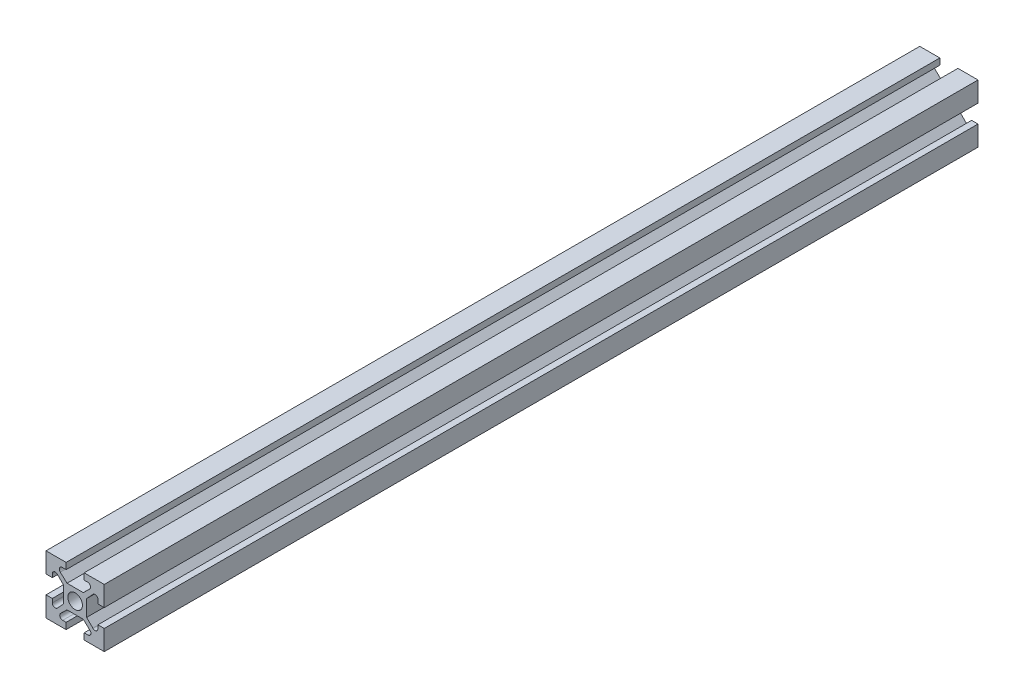
from build123d import *

# Parameters (mm, degrees)
SKETCH2_R           = 2.5
BOSS_EXTRUDE1_DEPTH = 300


with BuildPart() as part:
    # Sketch2 → Boss-Extrude1 (new body)
    with BuildSketch(Plane.XY):
        with BuildLine():
            Line((-10, -10), (-3.1, -10))
            Line((-3.1, -10), (-3.1, -7.81857447))
            Line((-3.1, -7.81857447), (-4.285374034, -7.81857447))
            ThreePointArc((-4.285374034, -7.81857447), (-5.210402021, -7.198473435), (-4.988208383, -6.107220917))
            Line((-4.988208383, -6.107220917), (-2.819718275, -3.96470075))
            Line((-2.819718275, -3.96470075), (0, -3.96470075))
            Line((0, -3.96470075), (2.782738033, -3.96470075))
            Line((2.782738033, -3.96470075), (5.105242131, -6.103332486))
            ThreePointArc((5.105242131, -6.103332486), (5.359419929, -7.202533996), (4.427854938, -7.838959152))
            Line((4.427854938, -7.838959152), (3.1, -7.838959152))
            Line((3.1, -7.838959152), (3.1, -10))
            Line((3.1, -10), (10, -10))
            Line((10, -10), (10, -3.1))
            Line((10, -3.1), (7.81857447, -3.1))
            Line((7.81857447, -3.1), (7.81857447, -4.285374034))
            ThreePointArc((7.81857447, -4.285374034), (7.198473435, -5.210402021), (6.107220917, -4.988208383))
            Line((6.107220917, -4.988208383), (3.96470075, -2.819718275))
            Line((3.96470075, -2.819718275), (3.96470075, 0))
            Line((3.96470075, 0), (3.96470075, 2.782738033))
            Line((3.96470075, 2.782738033), (6.103332486, 5.105242131))
            ThreePointArc((6.103332486, 5.105242131), (7.202533996, 5.359419929), (7.838959152, 4.427854938))
            Line((7.838959152, 4.427854938), (7.838959152, 3.1))
            Line((7.838959152, 3.1), (10, 3.1))
            Line((10, 3.1), (10, 10))
            Line((10, 10), (3.1, 10))
            Line((3.1, 10), (3.1, 7.81857447))
            Line((3.1, 7.81857447), (4.285374034, 7.81857447))
            ThreePointArc((4.285374034, 7.81857447), (5.210402021, 7.198473435), (4.988208383, 6.107220917))
            Line((4.988208383, 6.107220917), (2.819718275, 3.96470075))
            Line((2.819718275, 3.96470075), (0, 3.96470075))
            Line((0, 3.96470075), (-2.782738033, 3.96470075))
            Line((-2.782738033, 3.96470075), (-5.105242131, 6.103332486))
            ThreePointArc((-5.105242131, 6.103332486), (-5.359419929, 7.202533996), (-4.427854938, 7.838959152))
            Line((-4.427854938, 7.838959152), (-3.1, 7.838959152))
            Line((-3.1, 7.838959152), (-3.1, 10))
            Line((-3.1, 10), (-10, 10))
            Line((-10, 10), (-10, 3.1))
            Line((-10, 3.1), (-7.81857447, 3.1))
            Line((-7.81857447, 3.1), (-7.81857447, 4.285374034))
            ThreePointArc((-7.81857447, 4.285374034), (-7.198473435, 5.210402021), (-6.107220917, 4.988208383))
            Line((-6.107220917, 4.988208383), (-3.96470075, 2.819718275))
            Line((-3.96470075, 2.819718275), (-3.96470075, 0))
            Line((-3.96470075, 0), (-3.96470075, -2.782738033))
            Line((-3.96470075, -2.782738033), (-6.103332486, -5.105242131))
            ThreePointArc((-6.103332486, -5.105242131), (-7.202533996, -5.359419929), (-7.838959152, -4.427854938))
            Line((-7.838959152, -4.427854938), (-7.838959152, -3.1))
            Line((-7.838959152, -3.1), (-10, -3.1))
            Line((-10, -3.1), (-10, -10))
        make_face()
        Circle(SKETCH2_R, mode=Mode.SUBTRACT)
    extrude(amount=BOSS_EXTRUDE1_DEPTH)


solid = part.part
